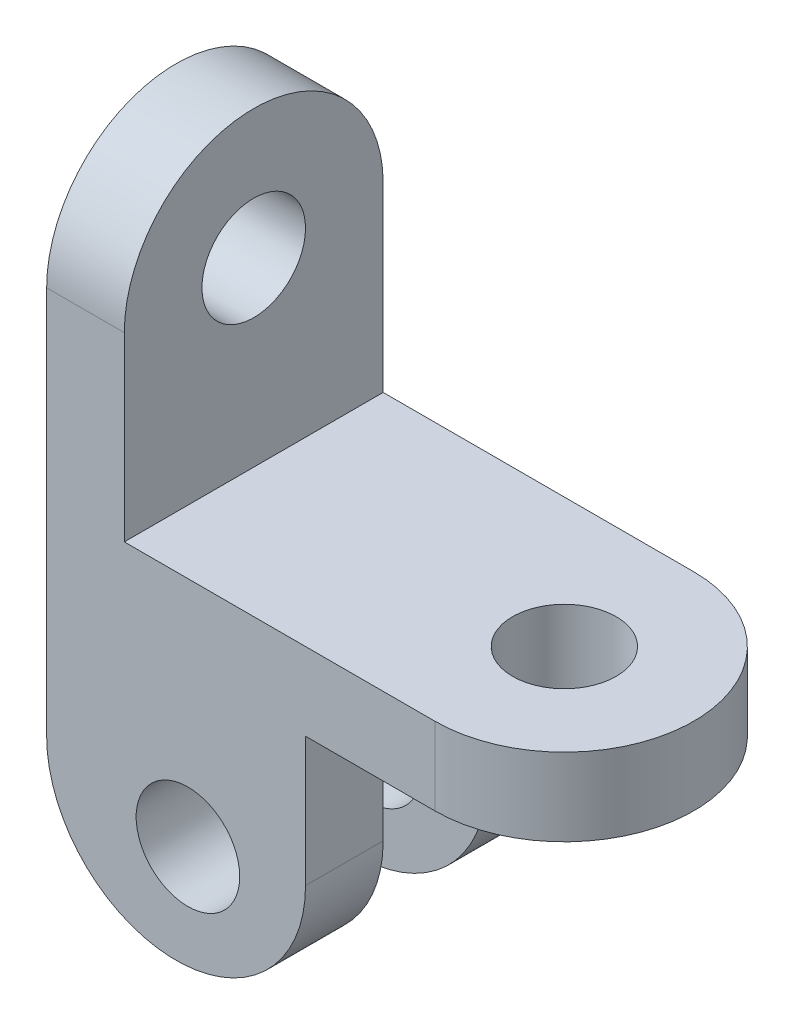
from build123d import *

# Parameters (mm, degrees)
BOSS_EXTRUDE1_DEPTH = 12
SKETCH2_R           = 8
CUT_EXTRUDE1_DEPTH  = 65.373907758
BOSS_EXTRUDE2_DEPTH = 12
SKETCH5_R           = 8
CUT_EXTRUDE2_DEPTH  = 93.86549413
BOSS_EXTRUDE3_DEPTH = 12
BOSS_EXTRUDE4_START = -28
BOSS_EXTRUDE4_DEPTH = 12
SKETCH10_R          = 8
CUT_EXTRUDE3_DEPTH  = 94.808315196


with BuildPart() as part:
    # Sketch1 → Boss-Extrude1 (new body)
    with BuildSketch(Plane(origin=(0, 0, 0), x_dir=(1, 0, 0), z_dir=(0, 1, 0))):
        with BuildLine():
            Line((0, 20), (-60, 20))
            Line((-60, 20), (-60, -20))
            Line((-60, -20), (0, -20))
            ThreePointArc((0, -20), (20, 0), (0, 20))
        make_face()
    extrude(amount=BOSS_EXTRUDE1_DEPTH)

    # Sketch2 → Cut-Extrude1 (cut, through all)
    with BuildSketch(Plane(origin=(0, 12, 0), x_dir=(1, 0, 0), z_dir=(0, 1, 0))):
        Circle(SKETCH2_R)
    extrude(amount=-CUT_EXTRUDE1_DEPTH, mode=Mode.SUBTRACT)

    # Sketch4 → Boss-Extrude2 (add)
    with BuildSketch(Plane.ZY.offset(60)):
        with BuildLine():
            Line((-20, 12), (20, 12))
            Line((20, 12), (20, 40))
            ThreePointArc((20, 40), (0, 60), (-20, 40))
            Line((-20, 40), (-20, 12))
        make_face()
    extrude(amount=-BOSS_EXTRUDE2_DEPTH)

    # Sketch5 → Cut-Extrude2 (cut, through all)
    with BuildSketch(Plane(origin=(-48, 0, 0), x_dir=(0, 0, -1), z_dir=(1, 0, 0))):
        with Locations((0, 40)):
            Circle(SKETCH5_R)
    extrude(amount=-CUT_EXTRUDE2_DEPTH, mode=Mode.SUBTRACT)

    # Sketch6 → Boss-Extrude3 (add)
    with BuildSketch(Plane.XY.offset(20)):
        with BuildLine():
            Line((-60, 0), (-20, 0))
            Line((-20, 0), (-20, -20))
            ThreePointArc((-20, -20), (-40, -40), (-60, -20))
            Line((-60, -20), (-60, 0))
        make_face()
    extrude(amount=-BOSS_EXTRUDE3_DEPTH)

    # Sketch6<2> → Boss-Extrude4 (add)
    with BuildSketch(Plane.XY.offset(20).offset(BOSS_EXTRUDE4_START)):
        with BuildLine():
            Line((-60, 0), (-20, 0))
            Line((-20, 0), (-20, -20))
            ThreePointArc((-20, -20), (-40, -40), (-60, -20))
            Line((-60, -20), (-60, 0))
        make_face()
    extrude(amount=-BOSS_EXTRUDE4_DEPTH)

    # Sketch10 → Cut-Extrude3 (cut, through all)
    with BuildSketch(Plane.XY.offset(20)):
        with Locations((-38.16922935, -23.880771307)):
            Circle(SKETCH10_R)
    extrude(amount=-CUT_EXTRUDE3_DEPTH, mode=Mode.SUBTRACT)


solid = part.part
